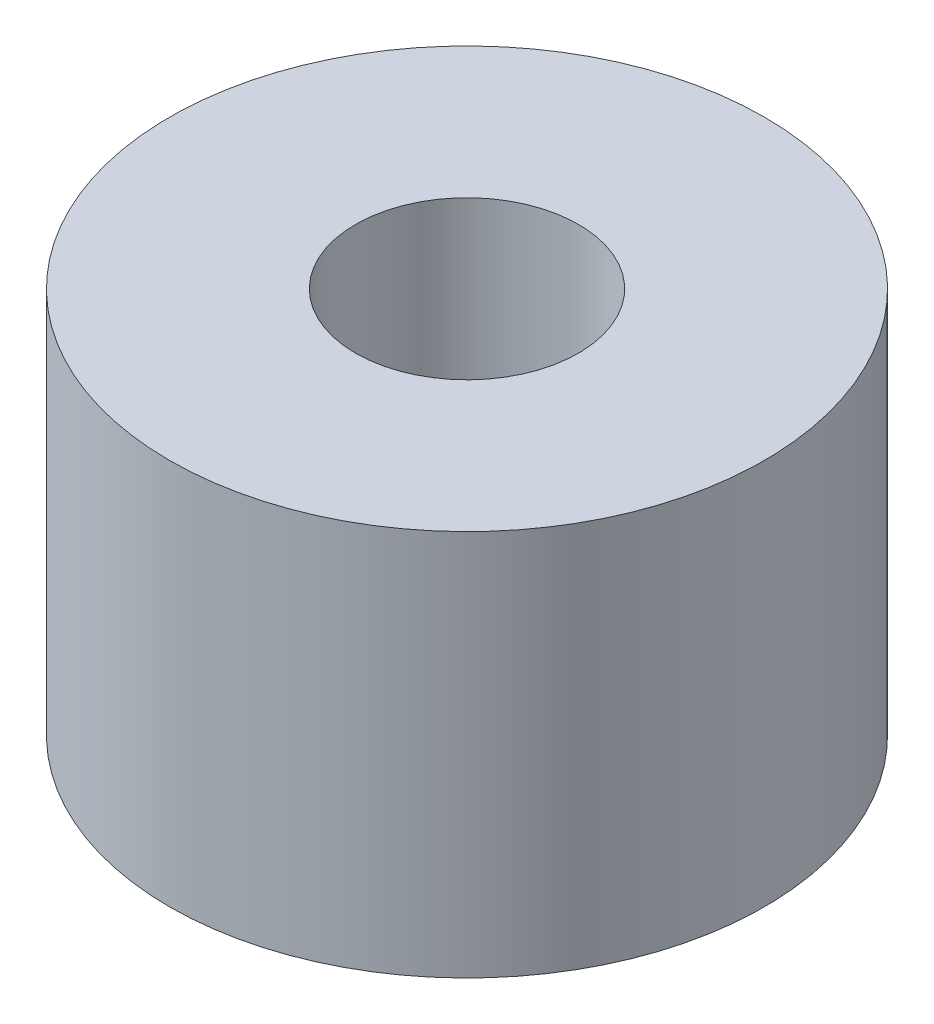
from build123d import *

# Parameters (mm, degrees)
SKETCH1_R           = 100
SKETCH1_R_2         = 37.5
BOSS_EXTRUDE1_DEPTH = 130


with BuildPart() as part:
    # Sketch1 → Boss-Extrude1 (new body)
    with BuildSketch(Plane(origin=(0, 0, 0), x_dir=(1, 0, 0), z_dir=(0, 1, 0))):
        with Locations(Location((0, 0, 0), (0, 0, 270))):
            Circle(SKETCH1_R)
        with Locations(Location((0, 0, 0), (0, 0, 270))):
            Circle(SKETCH1_R_2, mode=Mode.SUBTRACT)
    extrude(amount=BOSS_EXTRUDE1_DEPTH)


solid = part.part
